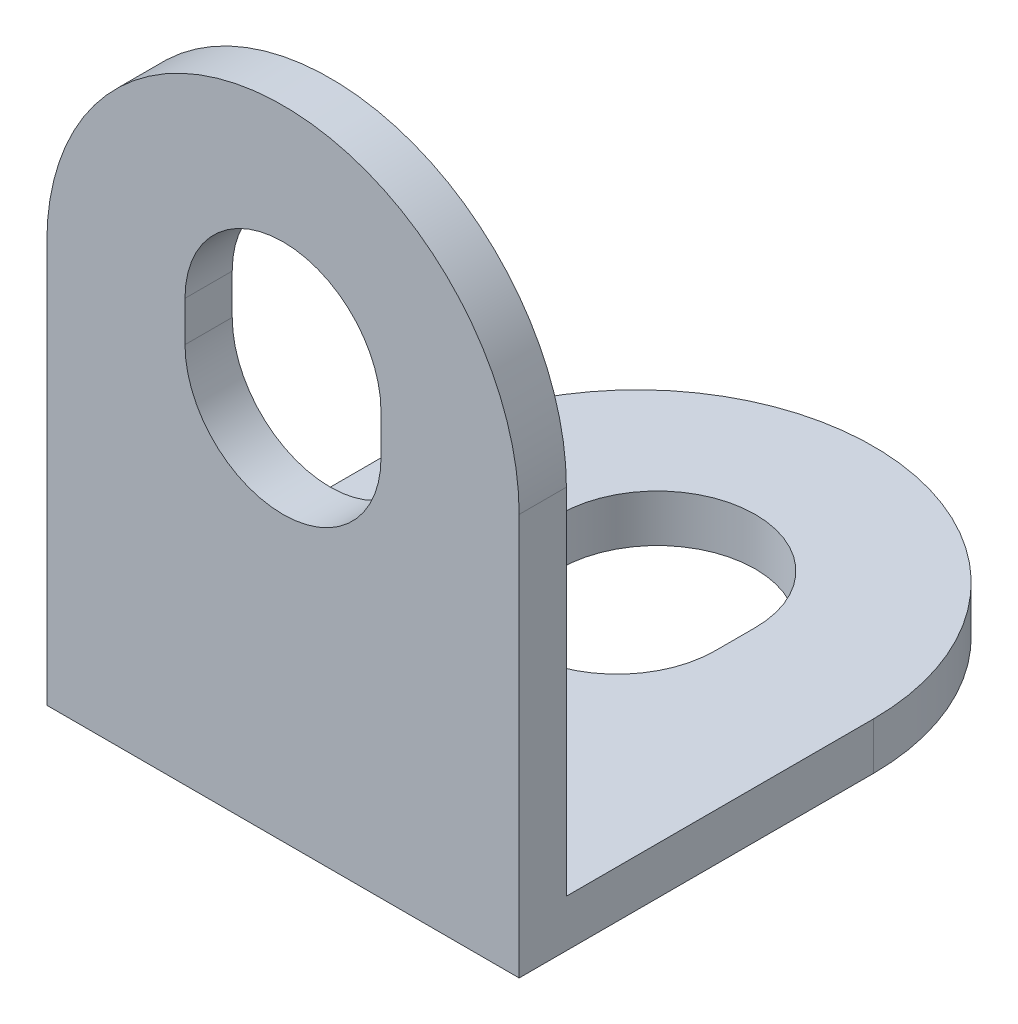
from build123d import *

# Parameters (mm, degrees)
BOSS_EXTRUDE1_DEPTH = 1
CIRPATTERN1_COUNT   = 2
CIRPATTERN1_ANGLE   = 90


with BuildPart() as part:
    # Sketch2 → Boss-Extrude1 (new body)
    with BuildSketch(Plane(origin=(0, 0, 0), x_dir=(1, 0, 0), z_dir=(0, 1, 0))):
        with BuildLine():
            Line((-5, 0), (-5, -7.5))
            Line((-5, -7.5), (5, -7.5))
            Line((5, -7.5), (5, 0))
            ThreePointArc((5, 0), (0, 5), (-5, 0))
        make_face()
        with BuildLine():
            Line((2.075, 0.425), (2.075, -0.425))
            ThreePointArc((2.075, -0.425), (0, -2.5), (-2.075, -0.425))
            Line((-2.075, -0.425), (-2.075, 0.425))
            ThreePointArc((-2.075, 0.425), (0, 2.5), (2.075, 0.425))
        make_face(mode=Mode.SUBTRACT)
    boss_extrude1 = extrude(amount=BOSS_EXTRUDE1_DEPTH)

    # CirPattern1: Boss-Extrude1 ×2 about axis
    cirpattern1_axis = Axis((-5, 1, 7.5), (1, 0, 0))
    for i in range(1, CIRPATTERN1_COUNT):
        add(boss_extrude1.rotate(cirpattern1_axis, i * CIRPATTERN1_ANGLE / (CIRPATTERN1_COUNT - 1)))


solid = part.part
